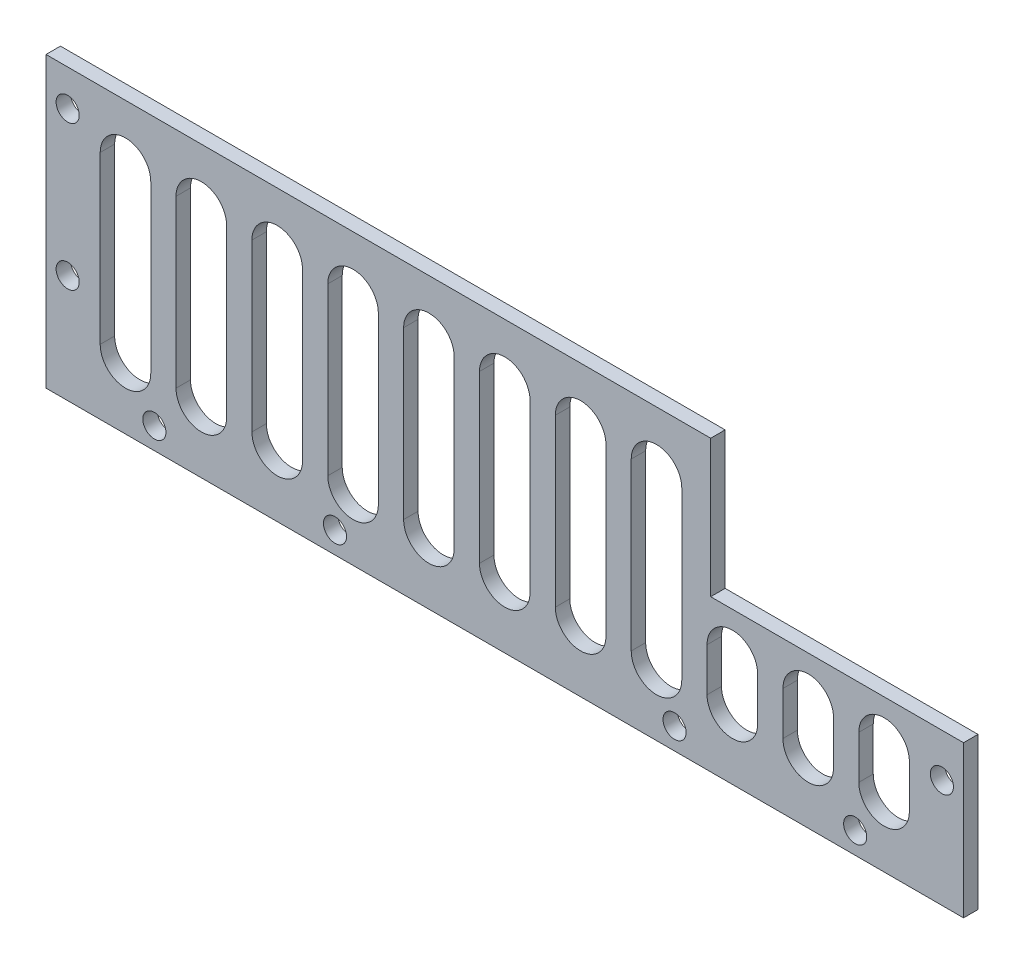
from build123d import *

# Parameters (mm, degrees)
SKETCH_1_W          = 6
SKETCH_1_H          = 40
SKETCH_1_R          = 1.6
SKETCH_1_W_2        = 115
EXTRUDE_1_DEPTH     = 2
CUT_EXTRUDE_1_DEPTH = 2
SKETCH_3_R          = 1.6
CUT_EXTRUDE_2_DEPTH = 67.605179979
CUT_EXTRUDE_3_DEPTH = 67.605179979
CUT_EXTRUDE_4_DEPTH = 67.605179979
SKETCH_6_W          = 35
SKETCH_6_H          = 19
CUT_EXTRUDE_5_DEPTH = 67.605179979


with BuildPart() as part:
    # 草图1 → 凸台-拉伸1 (new body)
    # profile 1 of 3: a face of its own
    with BuildSketch(Plane.XY):
        with Locations((-60.5, 0)):
            Rectangle(SKETCH_1_W, SKETCH_1_H)
        with Locations((-60.5, -5)):
            Circle(SKETCH_1_R, mode=Mode.SUBTRACT)
        with Locations((-60.5, 15)):
            Circle(SKETCH_1_R, mode=Mode.SUBTRACT)
    # profile 2 of 3: a face of its own
    with BuildSketch(Plane.XY):
        Rectangle(SKETCH_1_W_2, SKETCH_1_H)
    # profile 3 of 3: a face of its own
    with BuildSketch(Plane.XY):
        with Locations((60.5, 0)):
            Rectangle(SKETCH_1_W, SKETCH_1_H)
        with Locations((60.5, -5)):
            Circle(SKETCH_1_R, mode=Mode.SUBTRACT)
        with Locations((60.5, 15)):
            Circle(SKETCH_1_R, mode=Mode.SUBTRACT)
    extrude(amount=EXTRUDE_1_DEPTH)

    # 草图2 → 切除-拉伸1 (cut)
    with BuildSketch(Plane.XY.offset(2)):
        with BuildLine():
            Line((3.5, 12), (3.5, -11))
            ThreePointArc((3.5, -11), (0, -14.5), (-3.5, -11))
            Line((-3.5, -11), (-3.5, 12))
            ThreePointArc((-3.5, 12), (0, 15.5), (3.5, 12))
        make_face()
        with BuildLine():
            Line((14, 12), (14, -11))
            ThreePointArc((14, -11), (10.5, -14.5), (7, -11))
            Line((7, -11), (7, 12))
            ThreePointArc((7, 12), (10.5, 15.5), (14, 12))
        make_face()
        with BuildLine():
            Line((24.5, 12), (24.5, -11))
            ThreePointArc((24.5, -11), (21, -14.5), (17.5, -11))
            Line((17.5, -11), (17.5, 12))
            ThreePointArc((17.5, 12), (21, 15.5), (24.5, 12))
        make_face()
        with BuildLine():
            Line((-7, 12), (-7, -11))
            ThreePointArc((-7, -11), (-10.5, -14.5), (-14, -11))
            Line((-14, -11), (-14, 12))
            ThreePointArc((-14, 12), (-10.5, 15.5), (-7, 12))
        make_face()
        with BuildLine():
            Line((-17.5, 12), (-17.5, -11))
            ThreePointArc((-17.5, -11), (-21, -14.5), (-24.5, -11))
            Line((-24.5, -11), (-24.5, 12))
            ThreePointArc((-24.5, 12), (-21, 15.5), (-17.5, 12))
        make_face()
        with BuildLine():
            Line((-28, 12), (-28, -11))
            ThreePointArc((-28, -11), (-31.5, -14.5), (-35, -11))
            Line((-35, -11), (-35, 12))
            ThreePointArc((-35, 12), (-31.5, 15.5), (-28, 12))
        make_face()
        with BuildLine():
            Line((-38.5, 12), (-38.5, -11))
            ThreePointArc((-38.5, -11), (-42, -14.5), (-45.5, -11))
            Line((-45.5, -11), (-45.5, 12))
            ThreePointArc((-45.5, 12), (-42, 15.5), (-38.5, 12))
        make_face()
        with BuildLine():
            Line((-49, 12), (-49, -11))
            ThreePointArc((-49, -11), (-52.5, -14.5), (-56, -11))
            Line((-56, -11), (-56, 12))
            ThreePointArc((-56, 12), (-52.5, 15.5), (-49, 12))
        make_face()
    extrude(amount=-CUT_EXTRUDE_1_DEPTH, mode=Mode.SUBTRACT)

    # 草图3 → 切除-拉伸2 (cut, through all)
    with BuildSketch(Plane.XY.offset(2)):
        with Locations((-48.5, -17)):
            Circle(SKETCH_3_R)
        with Locations((-23.5, -17)):
            Circle(SKETCH_3_R)
        with Locations(Location((23.5, -17, 0), (0, 0, 180))):
            Circle(SKETCH_3_R)
        with Locations(Location((48.5, -17, 0), (0, 0, 180))):
            Circle(SKETCH_3_R)
    extrude(amount=-CUT_EXTRUDE_2_DEPTH, mode=Mode.SUBTRACT)

    # 草图4 → 切除-拉伸3 (cut, through all)
    with BuildSketch(Plane.XY.offset(2)):
        with BuildLine():
            Line((63.5, 5.4), (33.5, 5.4))
            ThreePointArc((33.5, 5.4), (32.5, 4.4), (31.5, 5.4))
            Line((31.5, 5.4), (31.5, 11.4))
            ThreePointArc((31.5, 11.4), (32.5, 12.4), (33.5, 11.4))
            Line((33.5, 11.4), (63.5, 11.4))
            Line((63.5, 11.4), (63.5, 5.4))
        make_face()
    extrude(amount=-CUT_EXTRUDE_3_DEPTH, mode=Mode.SUBTRACT)

    # 草图5 → 切除-拉伸4 (cut, through all)
    with BuildSketch(Plane.XY.offset(2)):
        with BuildLine():
            Line((35, -5), (35, -11))
            ThreePointArc((35, -11), (31.5, -14.5), (28, -11))
            Line((28, -11), (28, -5))
            ThreePointArc((28, -5), (31.5, -1.5), (35, -5))
        make_face()
        with BuildLine():
            Line((45.5, -5), (45.5, -11))
            ThreePointArc((45.5, -11), (42, -14.5), (38.5, -11))
            Line((38.5, -11), (38.5, -5))
            ThreePointArc((38.5, -5), (42, -1.5), (45.5, -5))
        make_face()
        with BuildLine():
            Line((56, -5), (56, -11))
            ThreePointArc((56, -11), (52.5, -14.5), (49, -11))
            Line((49, -11), (49, -5))
            ThreePointArc((49, -5), (52.5, -1.5), (56, -5))
        make_face()
    extrude(amount=-CUT_EXTRUDE_4_DEPTH, mode=Mode.SUBTRACT)

    # 草图6 → 切除-拉伸5 (cut, through all)
    with BuildSketch(Plane.XY.offset(2)):
        with Locations((46, 10.5)):
            Rectangle(SKETCH_6_W, SKETCH_6_H)
    extrude(amount=-CUT_EXTRUDE_5_DEPTH, mode=Mode.SUBTRACT)


solid = part.part
